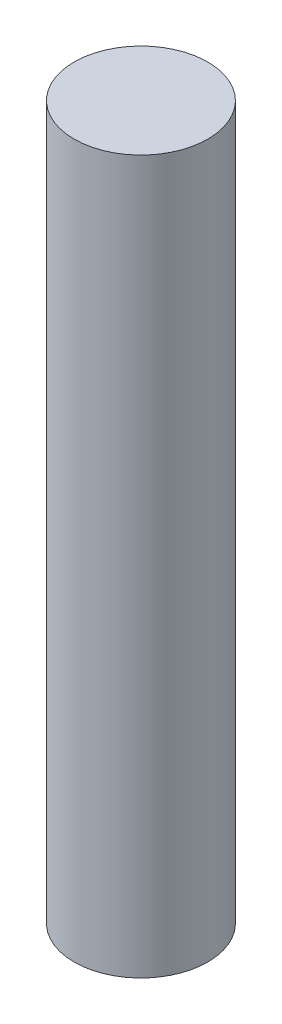
from build123d import *

# Parameters (mm, degrees)
SKETCH1_R           = 3
BOSS_EXTRUDE1_DEPTH = 32


with BuildPart() as part:
    # Sketch1 → Boss-Extrude1 (new body)
    with BuildSketch(Plane(origin=(0, 0, 0), x_dir=(1, 0, 0), z_dir=(0, 1, 0))):
        with Locations(Location((0, 0, 0), (0, 0, 270))):
            Circle(SKETCH1_R)
    extrude(amount=BOSS_EXTRUDE1_DEPTH)


solid = part.part
